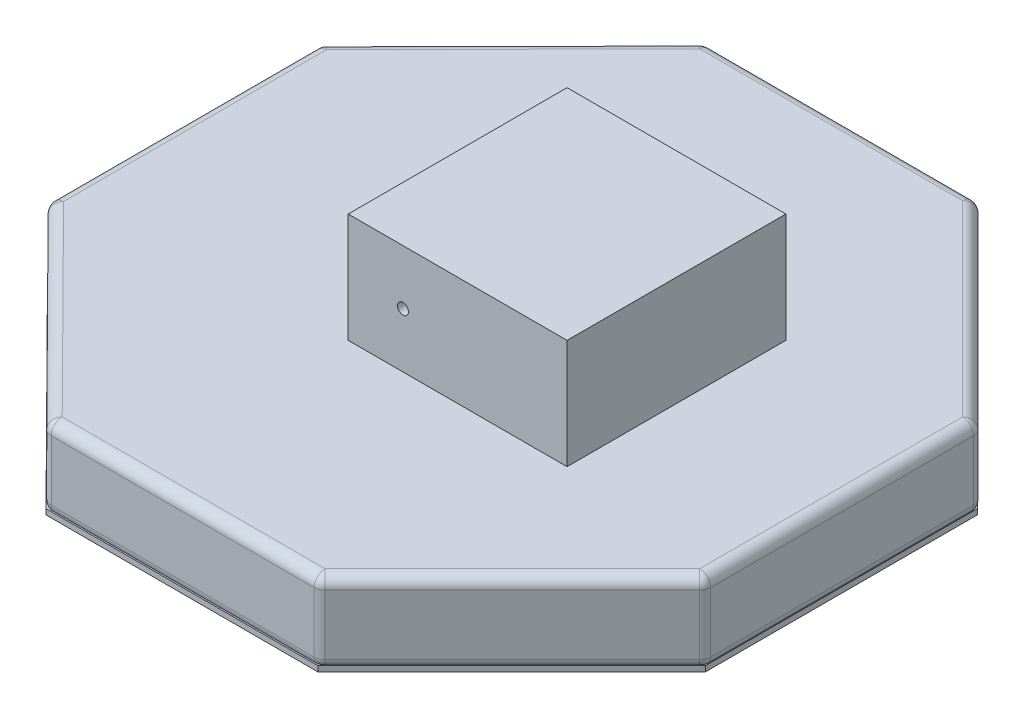
from build123d import *

# Parameters (mm, degrees)
BOSS_EXTRUDE2_DEPTH = 15
SKETCH3_W           = 40
SKETCH3_H           = 40
BOSS_EXTRUDE3_DEPTH = 20
FILLET2_R           = 2
SKETCH4_R           = 1
CUT_EXTRUDE1_DEPTH  = 40
BOSS_EXTRUDE4_DEPTH = 1


with BuildPart() as part:
    # Sketch2 → Boss-Extrude2 (new body)
    with BuildSketch(Plane(origin=(0, 0, 0), x_dir=(1, 0, 0), z_dir=(0, 1, 0))):
        Polygon((-60, -24.852813742), (-24.852813742, -60.262270904), (24.852813742, -60.262270904), (60.262270904, -24.852813742), (60.262270904, 24.852813742), (24.852813742, 60.262270904), (-24.852813742, 60.262270904), (-60, 24.852813742), align=None)
    extrude(amount=BOSS_EXTRUDE2_DEPTH)

    # Sketch3 → Boss-Extrude3 (add)
    with BuildSketch(Plane(origin=(0, 15, 0), x_dir=(1, 0, 0), z_dir=(0, 1, 0))):
        with Locations((10, 0)):
            Rectangle(SKETCH3_W, SKETCH3_H)
    extrude(amount=BOSS_EXTRUDE3_DEPTH)

    # Fillet2
    fillet2_edges = [part.edges().sort_by_distance(p)[0] for p in [
        (0, 0, 60.262270904),
        (-42.426406871, 0, 42.557542323),
        (-60, 0, 0),
        (-42.426406871, 0, -42.557542323),
        (-42.426406871, 15, 42.557542323),
        (-24.852813742, 7.5, -60.262270904),
        (24.852813742, 7.5, -60.262270904),
        (60.262270904, 7.5, -24.852813742),
        (60.262270904, 7.5, 24.852813742),
        (24.852813742, 7.5, 60.262270904),
        (-24.852813742, 7.5, 60.262270904),
        (-60, 7.5, 24.852813742),
        (-60, 7.5, -24.852813742),
        (0, 15, 60.262270904),
        (42.557542323, 15, 42.557542323),
        (60.262270904, 15, 0),
        (42.557542323, 15, -42.557542323),
        (0, 15, -60.262270904),
        (-42.426406871, 15, -42.557542323),
        (0, 0, -60.262270904),
        (-60, 15, 0),
        (42.557542323, 0, -42.557542323),
        (60.262270904, 0, 0),
        (42.557542323, 0, 42.557542323),
    ]]
    fillet(fillet2_edges, radius=FILLET2_R)

    # Sketch4 → Cut-Extrude1 (cut)
    with BuildSketch(Plane.XY.offset(20)):
        with Locations((0, 25)):
            Circle(SKETCH4_R)
    extrude(amount=-CUT_EXTRUDE1_DEPTH, mode=Mode.SUBTRACT)

    # Sketch1 → Boss-Extrude4 (add)
    with BuildSketch(Plane(origin=(0, 0, 0), x_dir=(1, 0, 0), z_dir=(0, 1, 0))):
        Polygon((-60.131135452, -24.852813742), (-24.983949194, -60.262270904), (24.72167829, -60.262270904), (60.131135452, -24.852813742), (60.131135452, 24.852813742), (24.72167829, 60.262270904), (-24.983949194, 60.262270904), (-60.131135452, 24.852813742), align=None)
    extrude(amount=BOSS_EXTRUDE4_DEPTH)


solid = part.part
